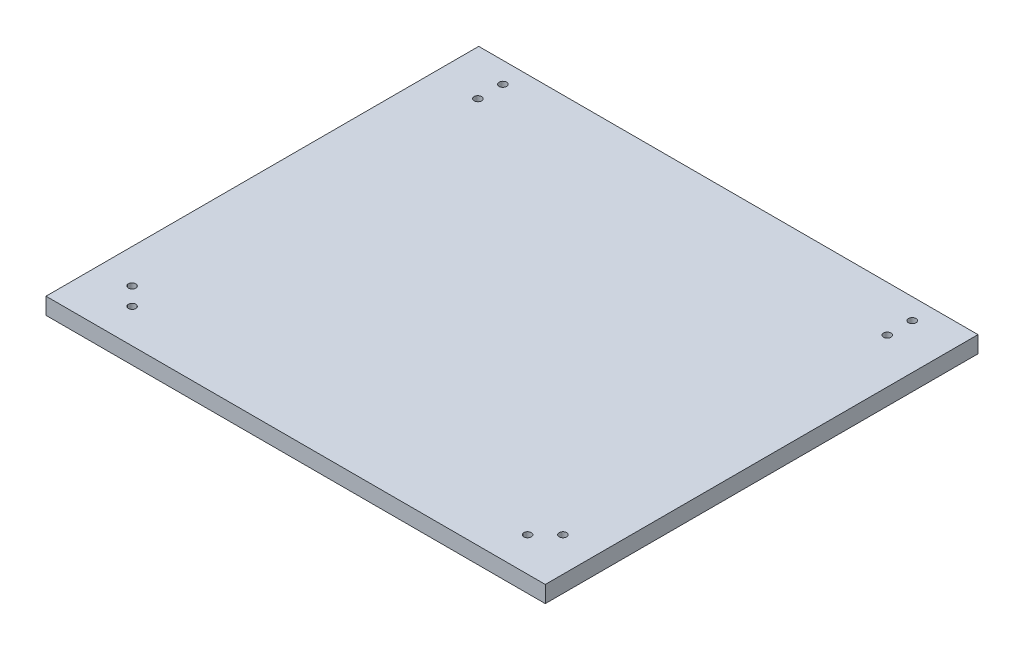
from build123d import *

# Parameters (mm, degrees)
SCHIZZO1_W                   = 300
SCHIZZO1_H                   = 260
ESTRUSIONE_ESTRUSIONE1_DEPTH = 10
SCHIZZO2_R                   = 2.25
TAGLIO_ESTRUSIONE1_DEPTH     = 10


with BuildPart() as part:
    # Schizzo1 → Estrusione-Estrusione1 (new body)
    with BuildSketch(Plane(origin=(0, 0, 0), x_dir=(1, 0, 0), z_dir=(0, 1, 0))):
        with Locations((-150, 130)):
            Rectangle(SCHIZZO1_W, SCHIZZO1_H)
    extrude(amount=ESTRUSIONE_ESTRUSIONE1_DEPTH)

    # Schizzo2 → Taglio-Estrusione1 (cut)
    with BuildSketch(Plane(origin=(0, 10, 0), x_dir=(1, 0, 0), z_dir=(0, 1, 0))):
        with Locations(Location((-268.838834765, 20.554563517, 0), (0, 0, 270))):
            Circle(SCHIZZO2_R)
        with Locations(Location((-279.445436483, 31.161165235, 0), (0, 0, 270))):
            Circle(SCHIZZO2_R)
        with Locations(Location((-20.554563517, 31.161165235, 0), (0, 0, 270))):
            Circle(SCHIZZO2_R)
        with Locations(Location((-31.161165235, 20.554563517, 0), (0, 0, 270))):
            Circle(SCHIZZO2_R)
        with Locations(Location((-273, 247.5, 0), (0, 0, 270))):
            Circle(SCHIZZO2_R)
        with Locations(Location((-273, 232.5, 0), (0, 0, 270))):
            Circle(SCHIZZO2_R)
        with Locations(Location((-27, 232.5, 0), (0, 0, 270))):
            Circle(SCHIZZO2_R)
        with Locations(Location((-27, 247.5, 0), (0, 0, 270))):
            Circle(SCHIZZO2_R)
    extrude(amount=-TAGLIO_ESTRUSIONE1_DEPTH, mode=Mode.SUBTRACT)


solid = part.part
